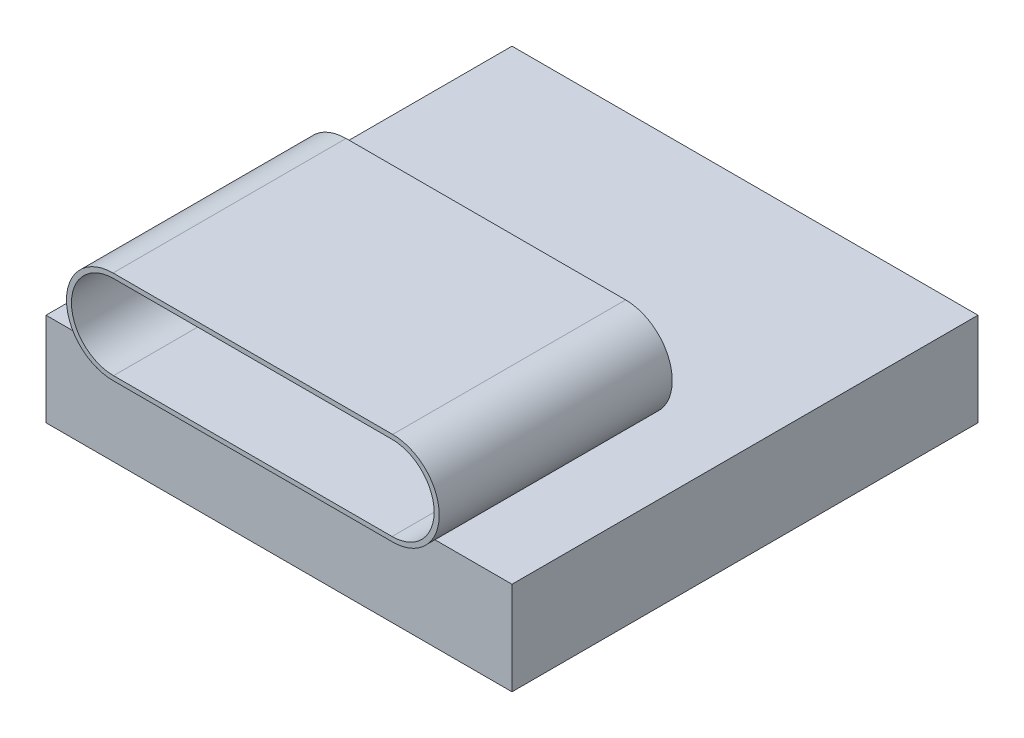
from build123d import *

# Parameters (mm, degrees)
SKETCH_1_W          = 10
SKETCH_1_H          = 13
EXTRUDE_1_DEPTH     = 2
EXTRUDE_3_DEPTH     = 5
CUT_EXTRUDE_1_DEPTH = 14.163674016
SKETCH_10_W         = 10
SKETCH_10_H         = 2
CUT_EXTRUDE_2_DEPTH = 2
SKETCH_11_W         = 10
SKETCH_11_H         = 2
CUT_EXTRUDE_3_DEPTH = 2
SKETCH_12_W         = 10
SKETCH_12_H         = 2
EXTRUDE_4_DEPTH     = 1


with BuildPart() as part:
    # 草图1 → 凸台-拉伸1 (new body)
    with BuildSketch(Plane(origin=(0, 0, 0), x_dir=(1, 0, 0), z_dir=(0, 1, 0))):
        Rectangle(SKETCH_1_W, SKETCH_1_H)
    extrude(amount=EXTRUDE_1_DEPTH)

    # 草图10 → 切除-拉伸2 (cut)
    with BuildSketch(Plane.XY.offset(6.5)):
        with Locations((0, 1)):
            Rectangle(SKETCH_10_W, SKETCH_10_H)
    extrude(amount=-CUT_EXTRUDE_2_DEPTH, mode=Mode.SUBTRACT)

    # 草图11 → 切除-拉伸3 (cut)
    with BuildSketch(Plane(origin=(0, 0, -6.5), x_dir=(-1, 0, 0), z_dir=(0, 0, -1))):
        with Locations((0, 1)):
            Rectangle(SKETCH_11_W, SKETCH_11_H)
    extrude(amount=-CUT_EXTRUDE_3_DEPTH, mode=Mode.SUBTRACT)

    # 草图12 → 凸台-拉伸4 (add)
    with BuildSketch(Plane(origin=(0, 0, -4.5), x_dir=(-1, 0, 0), z_dir=(0, 0, -1))):
        with Locations((0, 1)):
            Rectangle(SKETCH_12_W, SKETCH_12_H)
    extrude(amount=EXTRUDE_4_DEPTH)


with BuildPart() as body_2:
    # 草图2 → 凸台-拉伸3 (new body)
    with BuildSketch(Plane.XY):
        with BuildLine():
            Line((-3.061108679, 4.004037161), (2.938891321, 4.004037161))
            ThreePointArc((2.938891321, 4.004037161), (3.938891321, 3.004037161), (2.938891321, 2.004037161))
            Line((2.938891321, 2.004037161), (-3.061108679, 2.004037161))
            ThreePointArc((-3.061108679, 2.004037161), (-4.061108679, 3.004037161), (-3.061108679, 4.004037161))
        make_face()
    extrude(amount=EXTRUDE_3_DEPTH)

    # 草图5 → 切除-拉伸1 (cut, through all)
    with BuildSketch(Plane.XY.offset(5)):
        with BuildLine():
            Line((-3.050732039, 3.906131945), (2.926212364, 3.906131945))
            ThreePointArc((2.926212364, 3.906131945), (3.828980009, 3.003364301), (2.926212364, 2.100596657))
            Line((2.926212364, 2.100596657), (-3.050732039, 2.100596657))
            ThreePointArc((-3.050732039, 2.100596657), (-3.953499684, 3.003364301), (-3.050732039, 3.906131945))
        make_face()
    extrude(amount=-CUT_EXTRUDE_1_DEPTH, mode=Mode.SUBTRACT)


solid = Compound([part.part, body_2.part])
